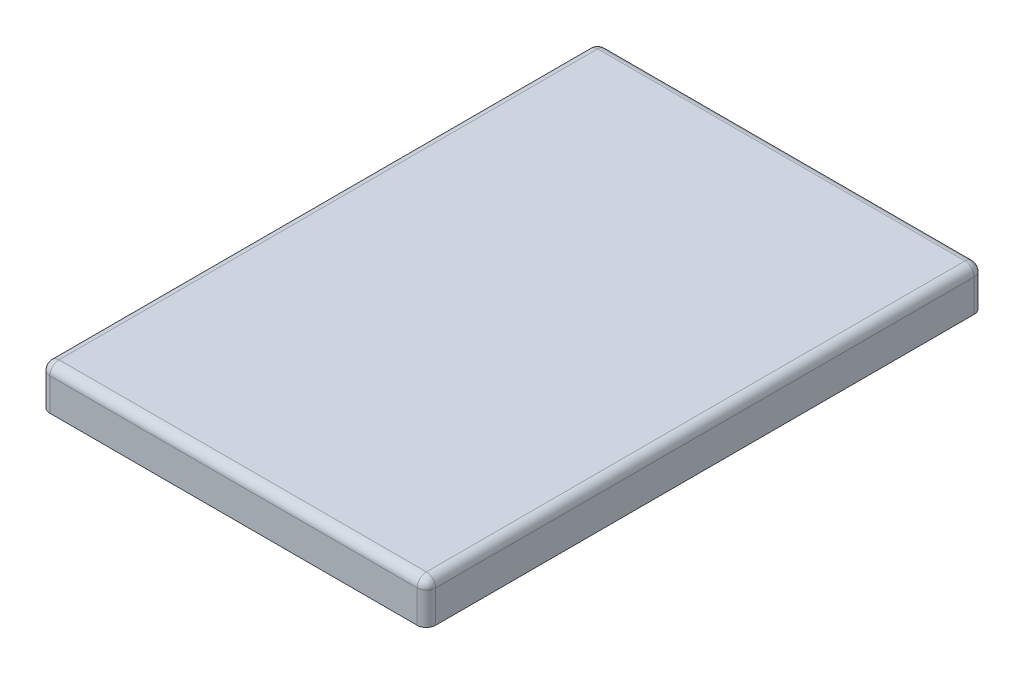
from build123d import *

# Parameters (mm, degrees)
MAIN_LID_W          = 41.7
MAIN_LID_H          = 60.2
BOSS_EXTRUDE1_DEPTH = 4.5
MAIN_LID_3_W        = 39.2
MAIN_LID_3_H        = 57.7
CUT_EXTRUDE1_DEPTH  = 2.65
SKETCH2_W           = 17.05
SKETCH2_H           = 0.9
CUT_EXTRUDE2_DEPTH  = 0.75
SKETCH3_W           = 37.7
SKETCH3_H           = 1.05
CUT_EXTRUDE3_DEPTH  = 0.75
SKETCH4_W           = 19.2
SKETCH4_H           = 0.9
CUT_EXTRUDE4_DEPTH  = 0.75
FILLET1_R           = 1


with BuildPart() as part:
    # Main_Lid → Boss-Extrude1 (new body)
    with BuildSketch(Plane(origin=(0, -69.305732589, 0), x_dir=(1, 0, 0), z_dir=(0, 1, 0))):
        with Locations((41.6, 0.1)):
            Rectangle(MAIN_LID_W, MAIN_LID_H)
    extrude(amount=BOSS_EXTRUDE1_DEPTH)

    # Main_Lid<3> → Cut-Extrude1 (cut)
    with BuildSketch(Plane(origin=(0, -69.305732589, 0), x_dir=(1, 0, 0), z_dir=(0, 1, 0))):
        with Locations((41.6, 0.1)):
            Rectangle(MAIN_LID_3_W, MAIN_LID_3_H)
    extrude(amount=CUT_EXTRUDE1_DEPTH, mode=Mode.SUBTRACT)

    # Sketch2 → Cut-Extrude2 (cut)
    with BuildSketch(Plane.XY.offset(-28.95)):
        with Locations((49.675, -68.055732589)):
            Rectangle(SKETCH2_W, SKETCH2_H)
    extrude(amount=-CUT_EXTRUDE2_DEPTH, mode=Mode.SUBTRACT)

    # Sketch3 → Cut-Extrude3 (cut)
    with BuildSketch(Plane.ZY.offset(-61.2)):
        with Locations((-0.1, -67.980732589)):
            Rectangle(SKETCH3_W, SKETCH3_H)
    extrude(amount=-CUT_EXTRUDE3_DEPTH, mode=Mode.SUBTRACT)

    # Sketch4 → Cut-Extrude4 (cut)
    with BuildSketch(Plane(origin=(0, 0, 28.75), x_dir=(-1, 0, 0), z_dir=(0, 0, -1))):
        with Locations((-41.6, -68.055732589)):
            Rectangle(SKETCH4_W, SKETCH4_H)
    extrude(amount=-CUT_EXTRUDE4_DEPTH, mode=Mode.SUBTRACT)

    # Fillet1
    fillet1_edges = [part.edges().sort_by_distance(p)[0] for p in [
        (41.6, -64.805732589, -30.2),
        (41.6, -64.805732589, 30),
        (20.75, -64.805732589, -0.1),
        (20.75, -67.055732589, 30),
        (62.45, -67.055732589, 30),
        (20.75, -67.055732589, -30.2),
        (62.45, -67.055732589, -30.2),
        (62.45, -64.805732589, -0.1),
    ]]
    fillet(fillet1_edges, radius=FILLET1_R)


solid = part.part
